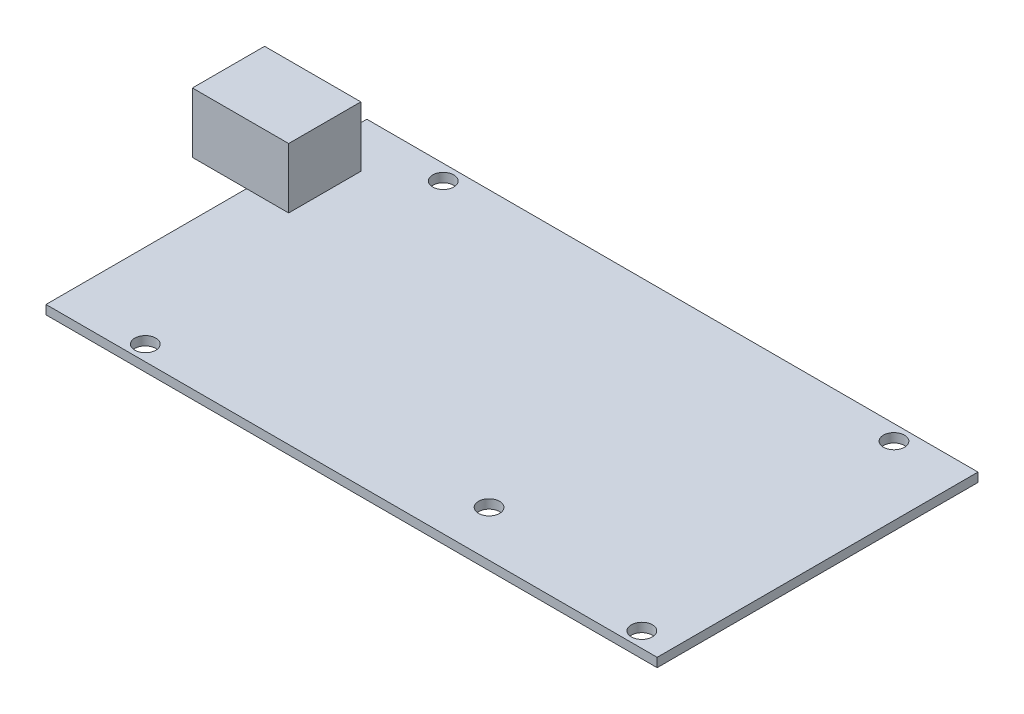
from build123d import *

# Parameters (mm, degrees)
SKETCH_1_W          = 101.6
SKETCH_1_H          = 53.34
EXTRUDE_1_DEPTH     = 1.5
SKETCH_2_W          = 16
SKETCH_2_H          = 12
EXTRUDE_2_DEPTH     = 10
SKETCH_3_W          = 6
SKETCH_3_H          = 2.163495019
CUT_EXTRUDE_1_DEPTH = 10
SKETCH_6_R          = 1.75
CUT_EXTRUDE_2_DEPTH = 74.684282714


with BuildPart() as part:
    # 草图1 → 凸台-拉伸1 (new body)
    with BuildSketch(Plane(origin=(0, 0, 0), x_dir=(1, 0, 0), z_dir=(0, 1, 0))):
        with Locations((14.806341463, 5.348455285)):
            Rectangle(SKETCH_1_W, SKETCH_1_H)
    extrude(amount=EXTRUDE_1_DEPTH)

    # 草图2 → 凸台-拉伸2 (add)
    with BuildSketch(Plane(origin=(0, 1.5, 0), x_dir=(1, 0, 0), z_dir=(0, 1, 0))):
        with Locations((-36.993658537, 18.018455285)):
            Rectangle(SKETCH_2_W, SKETCH_2_H)
    extrude(amount=EXTRUDE_2_DEPTH)

    # 草图3 → 切除-拉伸1 (cut)
    with BuildSketch(Plane.ZY.offset(44.993658537)):
        Polygon((-21.018455285, 10.5), (-23.018455285, 8.5), (-23.018455285, 2.5), (-13.018455285, 2.5), (-13.018455285, 8.5), (-15.018455285, 10.5), align=None)
        with Locations((-18.018455285, 6.471327075)):
            Rectangle(SKETCH_3_W, SKETCH_3_H, mode=Mode.SUBTRACT)
    extrude(amount=-CUT_EXTRUDE_1_DEPTH, mode=Mode.SUBTRACT)

    # 草图6 → 切除-拉伸2 (cut, through all)
    with BuildSketch(Plane(origin=(0, 1.5, 0), x_dir=(1, 0, 0), z_dir=(0, 1, 0))):
        with Locations(Location((-20.753658537, 29.478455285, 0), (0, 0, 270))):
            Circle(SKETCH_6_R)
        with Locations(Location((54.176341463, 29.478455285, 0), (0, 0, 270))):
            Circle(SKETCH_6_R)
        with Locations(Location((-22.023658537, -18.781544715, 0), (0, 0, 270))):
            Circle(SKETCH_6_R)
        with Locations(Location((30.046341463, -13.701544715, 0), (0, 0, 270))):
            Circle(SKETCH_6_R)
        with Locations(Location((60.526341463, -18.781544715, 0), (0, 0, 270))):
            Circle(SKETCH_6_R)
    extrude(amount=-CUT_EXTRUDE_2_DEPTH, mode=Mode.SUBTRACT)


solid = part.part
